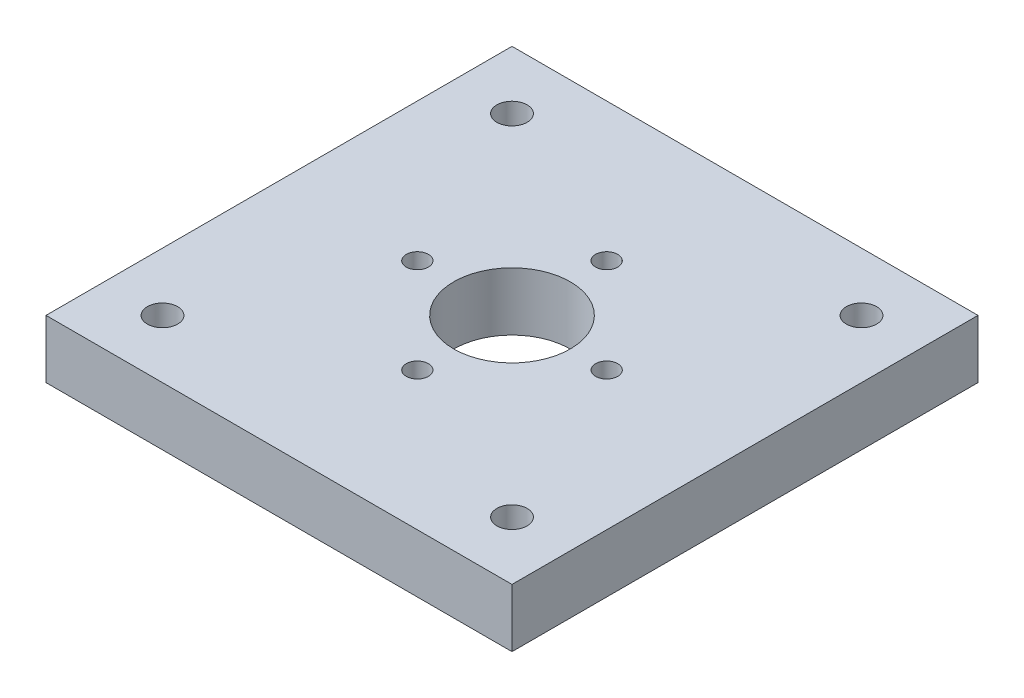
from build123d import *

# Parameters (mm, degrees)
SKETCH1_W           = 101.6
SKETCH1_H           = 101.6
SKETCH1_R           = 3.302
SKETCH1_R_2         = 12.7
SKETCH1_R_3         = 2.413
BOSS_EXTRUDE1_DEPTH = 6.35


with BuildPart() as part:
    # Sketch1 → Boss-Extrude1 (new, symmetric)
    with BuildSketch(Plane(origin=(0, 0, 0), x_dir=(1, 0, 0), z_dir=(0, 1, 0))):
        Rectangle(SKETCH1_W, SKETCH1_H)
        with Locations(Location((-38.1, 38.1, 0), (0, 0, 270))):
            Circle(SKETCH1_R, mode=Mode.SUBTRACT)
        with Locations(Location((-38.1, -38.1, 0), (0, 0, 90))):
            Circle(SKETCH1_R, mode=Mode.SUBTRACT)
        with Locations(Location((38.1, -38.1, 0), (0, 0, 270))):
            Circle(SKETCH1_R, mode=Mode.SUBTRACT)
        with Locations(Location((38.1, 38.1, 0), (0, 0, 90))):
            Circle(SKETCH1_R, mode=Mode.SUBTRACT)
        with Locations(Location((0, 0, 0), (0, 0, 270))):
            Circle(SKETCH1_R_2, mode=Mode.SUBTRACT)
        with Locations(Location((0, 20.6375, 0), (0, 0, 270))):
            Circle(SKETCH1_R_3, mode=Mode.SUBTRACT)
        with Locations(Location((0, -20.6375, 0), (0, 0, 90))):
            Circle(SKETCH1_R_3, mode=Mode.SUBTRACT)
        with Locations(Location((-20.6375, 0, 0), (0, 0, 270))):
            Circle(SKETCH1_R_3, mode=Mode.SUBTRACT)
        with Locations(Location((20.6375, 0, 0), (0, 0, 90))):
            Circle(SKETCH1_R_3, mode=Mode.SUBTRACT)
    extrude(amount=BOSS_EXTRUDE1_DEPTH, both=True)


solid = part.part
